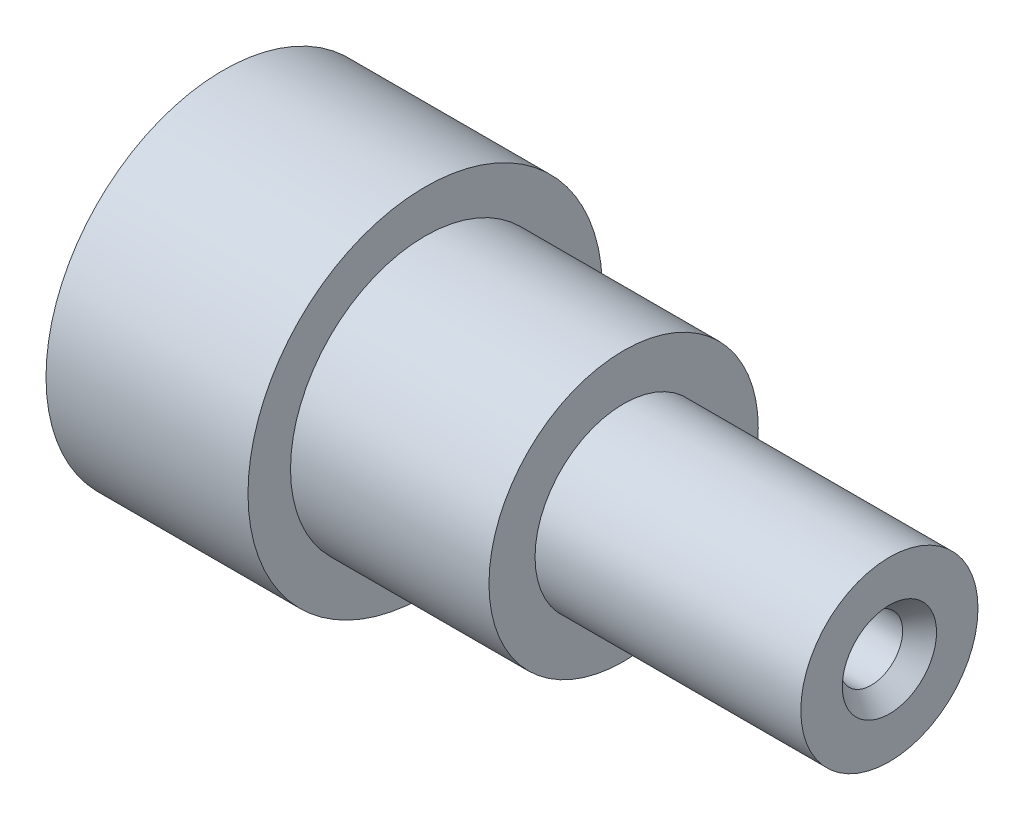
from build123d import *

# Parameters (mm, degrees)
F_12_24_TAPPED_HOLE1_D           = 4.4958
F_12_24_TAPPED_HOLE1_DEPTH       = 19.05
F_12_24_TAPPED_HOLE1_CSINK_D     = 6.7564
F_12_24_TAPPED_HOLE1_CSINK_ANGLE = 82
F_12_24_TAPPED_HOLE1_TIP         = 1.350674586


with BuildPart() as part:
    # Sketch3 → Revolve1 (revolve)
    with BuildSketch(Plane(origin=(0, 0, 0), x_dir=(1, 0, 0), z_dir=(0, 1, 0)), mode=Mode.PRIVATE) as revolve1_sk:
        Polygon((-22.600524836, 0), (25.151475164, 0), (25.151475164, 6.35), (6.101475164, 6.35), (6.101475164, 9.652), (-8.122524836, 9.652), (-8.122524836, 12.7), (-22.600524836, 12.7), align=None)
    revolve(revolve1_sk.sketch.rotate(Axis((-22.600524836, 0, 0), (1, 0, 0)), 180), axis=Axis((-22.600524836, 0, 0), (1, 0, 0)))

    # #12-24 Tapped Hole1
    with Locations(Plane(origin=(25.151475164, 0, 0), x_dir=(0, 0, -1), z_dir=(1, 0, 0))):
        with Locations((0, 0)):
            CounterSinkHole(F_12_24_TAPPED_HOLE1_D / 2, F_12_24_TAPPED_HOLE1_CSINK_D / 2, depth=F_12_24_TAPPED_HOLE1_DEPTH, counter_sink_angle=F_12_24_TAPPED_HOLE1_CSINK_ANGLE)
            with Locations((0, 0, -(F_12_24_TAPPED_HOLE1_DEPTH + F_12_24_TAPPED_HOLE1_TIP / 2))):  # 118° drill point
                Cone(0, F_12_24_TAPPED_HOLE1_D / 2, F_12_24_TAPPED_HOLE1_TIP, mode=Mode.SUBTRACT)


solid = part.part
